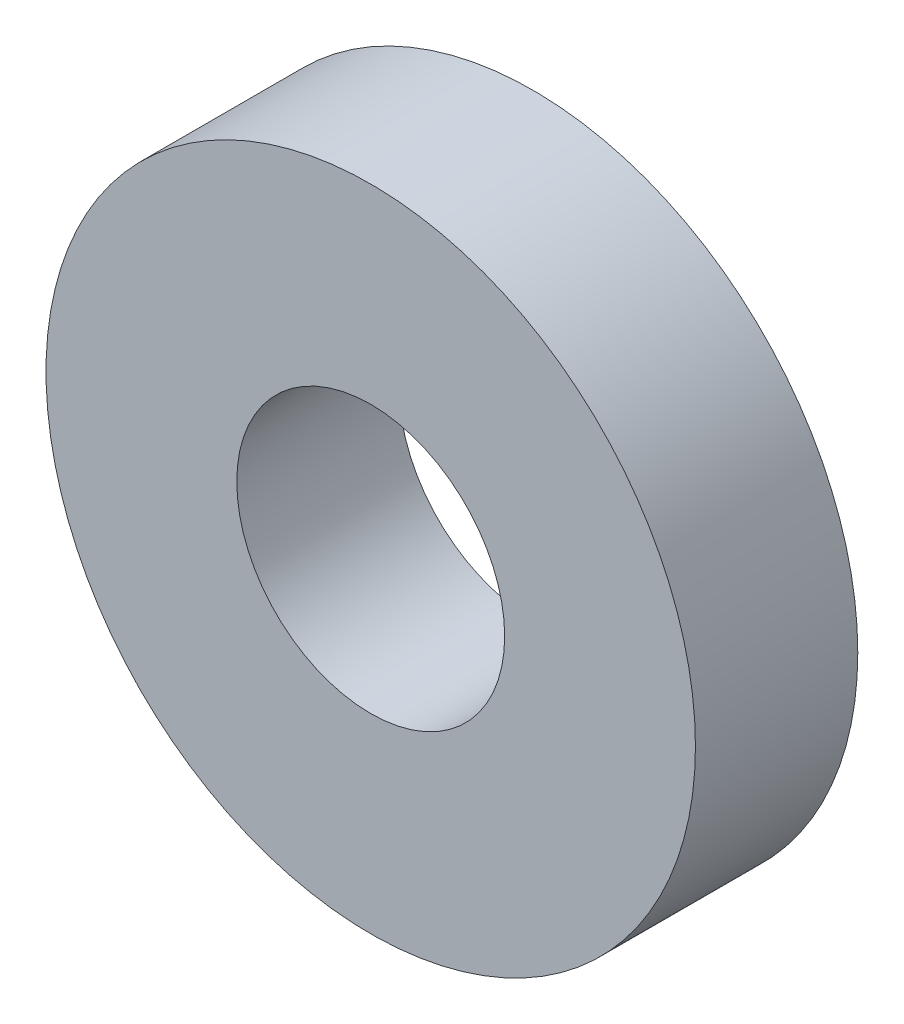
from build123d import *

# Parameters (mm, degrees)
SKETCH_1_R     = 4
SKETCH_1_R_2   = 1.65
D435_2MM_DEPTH = 2


with BuildPart() as part:
    # 草图1 → D435后支承垫片_2mm (new body)
    with BuildSketch(Plane.XY):
        Circle(SKETCH_1_R)
        Circle(SKETCH_1_R_2, mode=Mode.SUBTRACT)
    extrude(amount=D435_2MM_DEPTH)


solid = part.part
